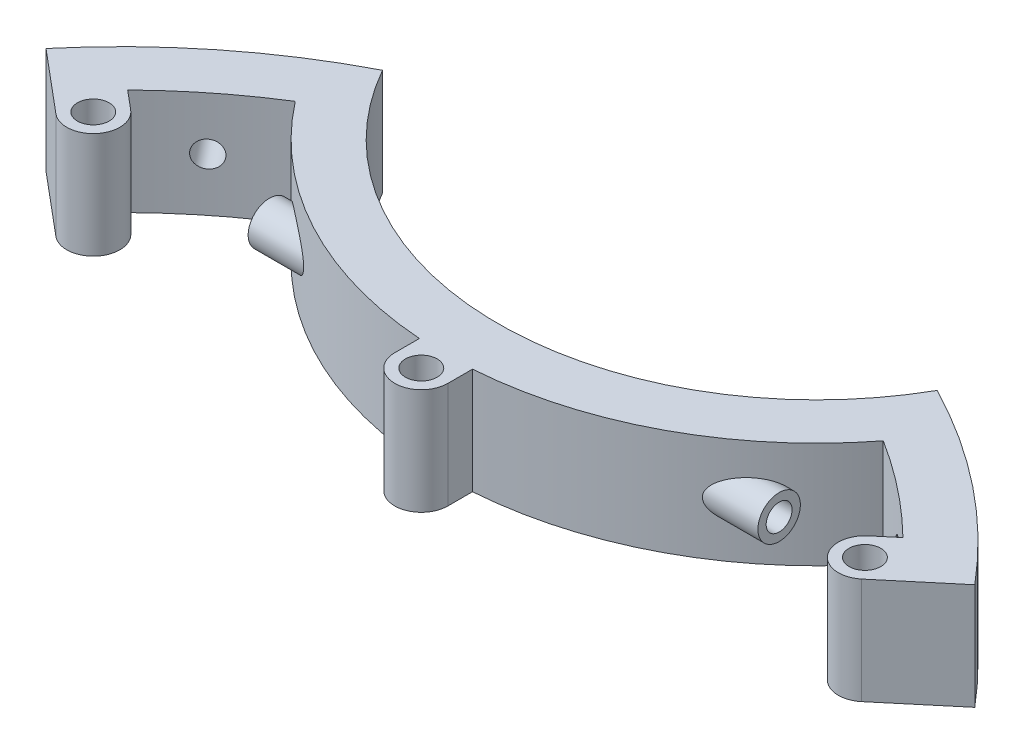
from build123d import *

# Parameters (mm, degrees)
BOSS_EXTRUDE1_DEPTH   = 12.7
CUT_EXTRUDE1_REACH    = 105.136
SKETCH4_R             = 1.55
BOSS_EXTRUDE2_START   = -12.7
BOSS_EXTRUDE2_DEPTH   = 12.7
BOSS_EXTRUDE4_START   = -12.7
BOSS_EXTRUDE4_DEPTH   = 12.7
CUT_EXTRUDE2_REACH    = 88.037
SKETCH9_R             = 1.55
BOSS_EXTRUDE3_START   = -22.86
SKETCH9_3_R           = 2.54
SKETCH9_3_R_2         = 1.55
BOSS_EXTRUDE3_DEPTH   = 7.62
F_6_CLEARANCE_HOLE1_D = 3.7973


with BuildPart() as part:
    # Sketch1 → Boss-Extrude1 (new body)
    with BuildSketch(Plane(origin=(0, 0, 0), x_dir=(1, 0, 0), z_dir=(0, 1, 0))):
        with BuildLine():
            ThreePointArc((-33.160552015, 64.471914738), (-45.240476214, 56.65288441), (-55.538222126, 46.602101702))
            Line((-55.538222126, 46.602101702), (-50.673839912, 42.520400381))
            ThreePointArc((-50.673839912, 42.520400381), (-43.444022026, 49.884260546), (-35.15688403, 56.034061117))
            ThreePointArc((-35.15688403, 56.034061117), (0, 38.783252378), (35.15688403, 56.034061117))
            ThreePointArc((35.15688403, 56.034061117), (43.444022026, 49.884260546), (50.673839912, 42.520400381))
            Line((50.673839912, 42.520400381), (55.538222126, 46.602101702))
            ThreePointArc((55.538222126, 46.602101702), (45.240476214, 56.65288441), (33.160552015, 64.471914738))
            ThreePointArc((33.160552015, 64.471914738), (0, 45.133252378), (-33.160552015, 64.471914738))
        make_face()
    extrude(amount=BOSS_EXTRUDE1_DEPTH)

    # Sketch4 → Cut-Extrude1 (cut, up to next)
    with BuildSketch(Plane(origin=(-45.240476214, 12.7, -56.65288441), x_dir=(-0.7814190953093677, 0, 0.6240065684637377), z_dir=(-0.6240065684637377, 0, -0.7814190953093677)), mode=Mode.PRIVATE) as cut_extrude1_sk1:
        with Locations((0, -6.35)):
            Circle(SKETCH4_R)
    cut_extrude1_tool1 = extrude(cut_extrude1_sk1.sketch, amount=-CUT_EXTRUDE1_REACH, mode=Mode.PRIVATE) & part.part
    cut_extrude1 = cut_extrude1_tool1.solids().sort_by_distance((-45.240476, 6.35, -56.652884))[0]
    add(cut_extrude1, mode=Mode.SUBTRACT)

    # Sketch5 → Boss-Extrude2 (add)
    with BuildSketch(Plane(origin=(0, 12.7, 0), x_dir=(1, 0, 0), z_dir=(0, 1, 0)).offset(BOSS_EXTRUDE2_START)):
        with BuildLine():
            Line((-48.180298109, 40.428070373), (-50.673839912, 42.520400381))
            ThreePointArc((-50.673839912, 42.520400381), (-48.57209115, 44.906285321), (-46.358122599, 47.188419862))
            Line((-46.358122599, 47.188419862), (-44.098596788, 45.292452587))
            ThreePointArc((-44.098596788, 45.292452587), (-43.707256341, 40.81941082), (-48.180298109, 40.428070373))
        make_face()
    boss_extrude2 = extrude(amount=BOSS_EXTRUDE2_DEPTH)

    # Sketch10 → Boss-Extrude4 (add)
    with BuildSketch(Plane(origin=(0, 12.7, 0), x_dir=(1, 0, 0), z_dir=(0, 1, 0)).offset(BOSS_EXTRUDE4_START)):
        with BuildLine():
            Line((-3.175, 38.896790239), (-3.175, 35.947188775))
            ThreePointArc((-3.175, 35.947188775), (0, 32.772188775), (3.175, 35.947188775))
            Line((3.175, 35.947188775), (3.175, 38.896790239))
            ThreePointArc((3.175, 38.896790239), (0, 38.783252378), (-3.175, 38.896790239))
        make_face()
    extrude(amount=BOSS_EXTRUDE4_DEPTH)

    # Sketch9 → Cut-Extrude2 (cut, up to next)
    with BuildSketch(Plane(origin=(0, 0, 0), x_dir=(0, 0, -1), z_dir=(1, 0, 0)), mode=Mode.PRIVATE) as cut_extrude2_sk1:
        with Locations((48.26, 6.35)):
            Circle(SKETCH9_R)
    cut_extrude2_tool1 = extrude(cut_extrude2_sk1.sketch, amount=-CUT_EXTRUDE2_REACH, mode=Mode.PRIVATE) & part.part
    cut_extrude2 = cut_extrude2_tool1.solids().sort_by_distance((0, 6.35, -48.26))[0]
    add(cut_extrude2, mode=Mode.SUBTRACT)

    # Sketch9<3> → Boss-Extrude3 (add)
    with BuildSketch(Plane(origin=(0, 0, 0), x_dir=(0, 0, -1), z_dir=(1, 0, 0)).offset(BOSS_EXTRUDE3_START)):
        with Locations((48.26, 6.35)):
            Circle(SKETCH9_3_R)
        with Locations((48.26, 6.35)):
            Circle(SKETCH9_3_R_2, mode=Mode.SUBTRACT)
    boss_extrude3 = extrude(amount=-BOSS_EXTRUDE3_DEPTH)

    # Mirror1: Cut-Extrude1, Boss-Extrude2, Cut-Extrude2, Boss-Extrude3 across plane
    add(cut_extrude1.mirror(Plane(origin=(0, 0, 0), x_dir=(0, 0, 1), z_dir=(1, 0, 0))), mode=Mode.SUBTRACT)
    add(boss_extrude2.mirror(Plane(origin=(0, 0, 0), x_dir=(0, 0, 1), z_dir=(1, 0, 0))))
    add(cut_extrude2.mirror(Plane(origin=(0, 0, 0), x_dir=(0, 0, 1), z_dir=(1, 0, 0))), mode=Mode.SUBTRACT)
    add(boss_extrude3.mirror(Plane(origin=(0, 0, 0), x_dir=(0, 0, 1), z_dir=(1, 0, 0))))

    # #6 Clearance Hole1 (through all)
    with Locations(Plane(origin=(0, 12.7, 0), x_dir=(1, 0, 0), z_dir=(0, 1, 0))):
        with Locations((-46.139447448, 42.86026148), (46.139447448, 42.86026148), (0, 35.947188775)):
            Hole(F_6_CLEARANCE_HOLE1_D / 2)


solid = part.part
